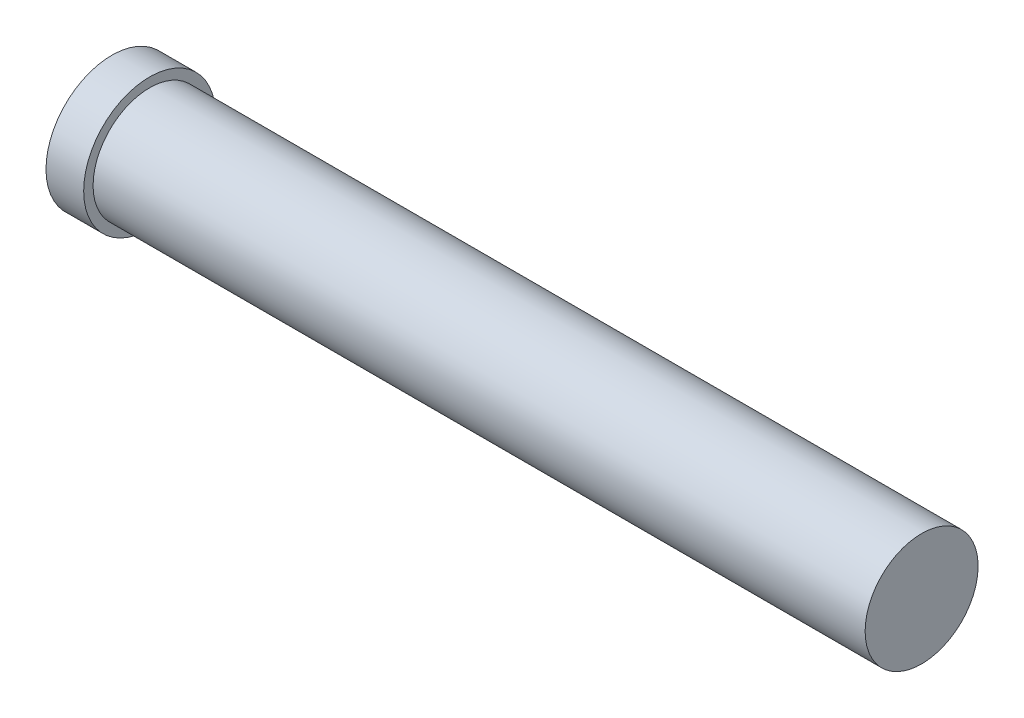
from build123d import *


with BuildPart() as part:
    # Çizim1 → Döndür1 (revolve)
    with BuildSketch(Plane.XY, mode=Mode.PRIVATE) as d_nd_r1_sk:
        Polygon((0, 0), (0, 35), (20, 35), (20, 30), (430, 30), (430, 0), align=None)
    revolve(d_nd_r1_sk.sketch.rotate(Axis((0, 0, 0), (1, 0, 0)), 90), axis=Axis((0, 0, 0), (1, 0, 0)))


solid = part.part
